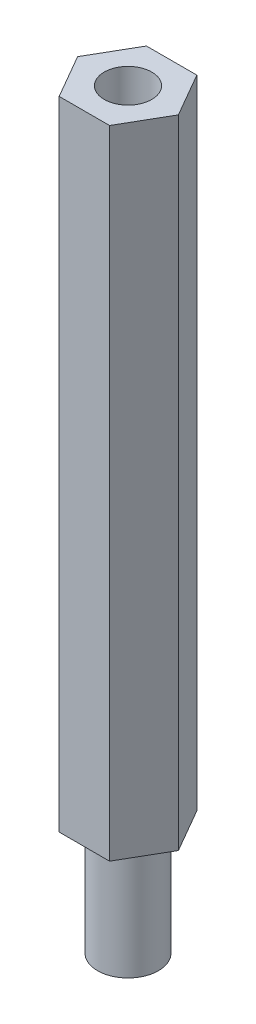
from build123d import *

# Parameters (mm, degrees)
EXTRUDE_1_DEPTH     = 33.5
SKETCH_6_R          = 1.6
EXTRUDE_2_DEPTH     = 6
SKETCH_7_R          = 1.25
CUT_EXTRUDE_1_DEPTH = 5


with BuildPart() as part:
    # 草图4 → 凸台-拉伸1 (new body)
    with BuildSketch(Plane(origin=(0, 0, 0), x_dir=(1, 0, 0), z_dir=(0, 1, 0))):
        Polygon((1.325, -2.29496732), (2.65, 0), (1.325, 2.29496732), (-1.325, 2.29496732), (-2.65, 0), (-1.325, -2.29496732), align=None)
    extrude(amount=EXTRUDE_1_DEPTH)

    # 草图6 → 凸台-拉伸2 (add)
    with BuildSketch(Plane(origin=(0, 0, 0), x_dir=(-1, 0, 0), z_dir=(0, -1, 0))):
        with Locations(Location((0, 0, 0), (0, 0, 270))):
            Circle(SKETCH_6_R)
    extrude(amount=EXTRUDE_2_DEPTH)

    # 草图7 → 切除-拉伸1 (cut)
    with BuildSketch(Plane(origin=(0, 33.5, 0), x_dir=(1, 0, 0), z_dir=(0, 1, 0))):
        with Locations(Location((0, 0, 0), (0, 0, 270))):
            Circle(SKETCH_7_R)
    extrude(amount=-CUT_EXTRUDE_1_DEPTH, mode=Mode.SUBTRACT)


solid = part.part
